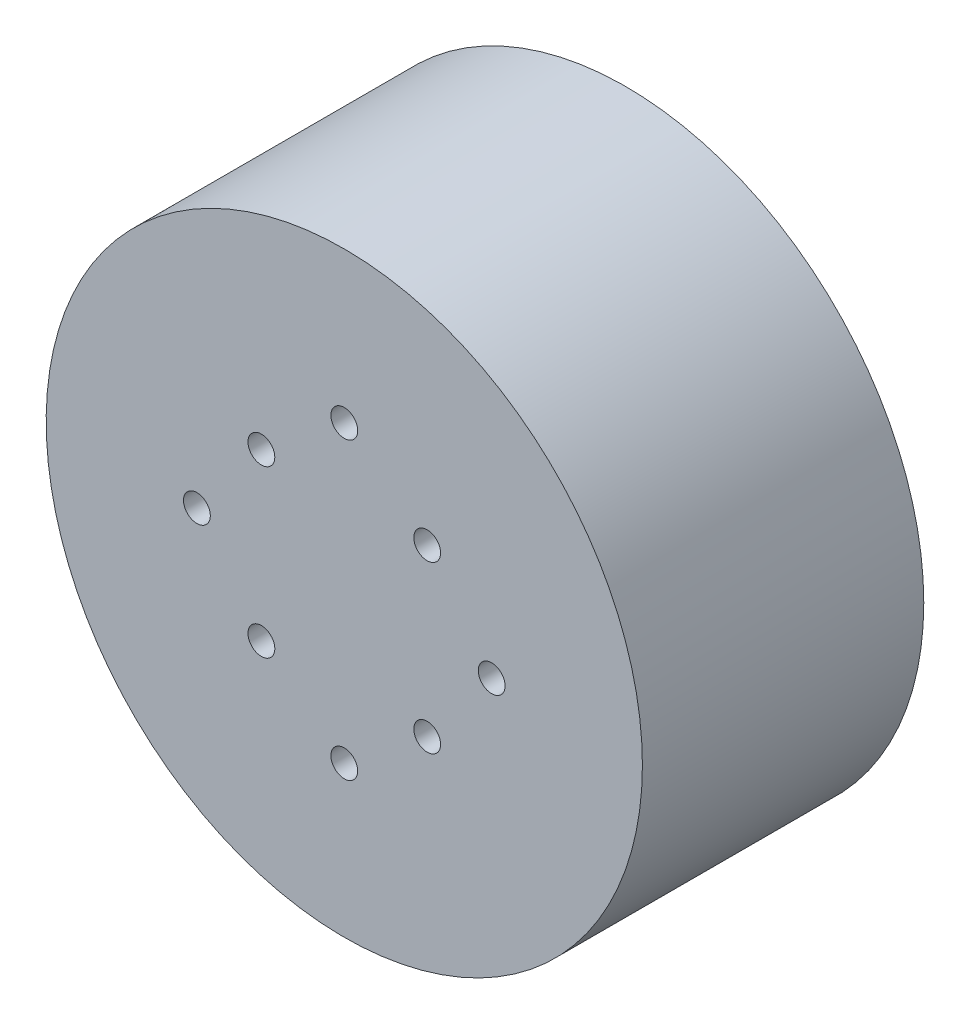
from build123d import *

# Parameters (mm, degrees)
SKETCH_1_R               = 44.5
EXTRUDE_1_DEPTH          = 42
HOLE_WIZARD_M4_1_D       = 3.3
HOLE_WIZARD_M4_1_DEPTH   = 12
HOLE_WIZARD_M4_1_TIP     = 0.991420021
SKETCH_4_R               = 2
CUT_EXTRUDE_1_DEPTH      = 10
PATTERN_CIRCULAR_1_COUNT = 4
SKETCH_5_W               = 19.478252765
SKETCH_5_H               = 48.547320344
CUT_EXTRUDE_2_DEPTH      = 10
SKETCH_6_W               = 5.245291094
SKETCH_6_H               = 29.052548629
CUT_EXTRUDE_3_DEPTH      = 10


with BuildPart() as part:
    # 草图1 → 凸台-拉伸1 (new body)
    with BuildSketch(Plane.XY):
        with Locations(Location((0, 0, 0), (0, 0, 180))):
            Circle(SKETCH_1_R)
    extrude(amount=EXTRUDE_1_DEPTH)

    # M4 螺纹孔的螺纹孔钻头1
    with Locations(Plane(origin=(15, 15, 0), x_dir=(-1, 0, 0), z_dir=(0, 0, -1))):
        with Locations((0, 0), (30, 0), (30, -30), (0, -30)):
            Hole(HOLE_WIZARD_M4_1_D / 2, depth=HOLE_WIZARD_M4_1_DEPTH)
            with Locations((0, 0, -(HOLE_WIZARD_M4_1_DEPTH + HOLE_WIZARD_M4_1_TIP / 2))):  # 118° drill point
                Cone(0, HOLE_WIZARD_M4_1_D / 2, HOLE_WIZARD_M4_1_TIP, mode=Mode.SUBTRACT)

    # 草图4 → 切除-拉伸1 (cut)
    with BuildSketch(Plane.XY.offset(42)):
        with Locations((0, 22)):
            Circle(SKETCH_4_R)
        with Locations((12.374368671, 12.374368671)):
            Circle(SKETCH_4_R)
    cut_extrude_1 = extrude(amount=-CUT_EXTRUDE_1_DEPTH, mode=Mode.SUBTRACT)

    # 阵列(圆周)1: 切除-拉伸1 ×4 about axis
    pattern_circular_1_axis = Axis((0, 0, 0), (0, 0, 1))
    for i in range(1, PATTERN_CIRCULAR_1_COUNT):
        add(cut_extrude_1.rotate(pattern_circular_1_axis, i * 360 / PATTERN_CIRCULAR_1_COUNT), mode=Mode.SUBTRACT)

    # 草图5 → 切除-拉伸2 (cut)
    with BuildSketch(Plane(origin=(0, 0, 0), x_dir=(-1, 0, 0), z_dir=(0, 0, -1))):
        with Locations((48.243799035, -1.742903496)):
            Rectangle(SKETCH_5_W, SKETCH_5_H)
    extrude(amount=-CUT_EXTRUDE_2_DEPTH, mode=Mode.SUBTRACT)

    # 草图6 → 切除-拉伸3 (cut)
    with BuildSketch(Plane.ZY.offset(38.504672652)):
        with Locations((5.335468617, -0.326949721)):
            Rectangle(SKETCH_6_W, SKETCH_6_H)
    extrude(amount=-CUT_EXTRUDE_3_DEPTH, mode=Mode.SUBTRACT)


solid = part.part
